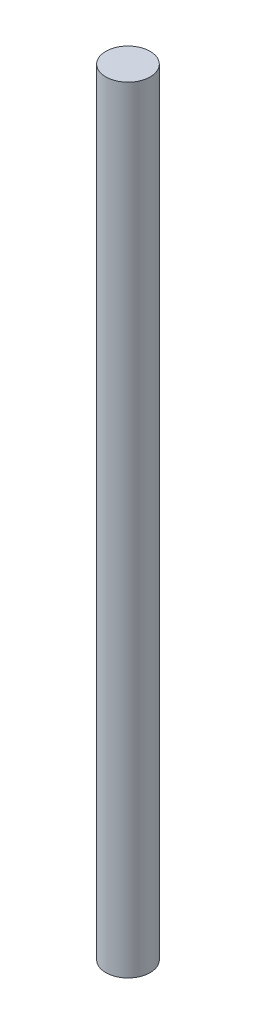
from build123d import *

# Parameters (mm, degrees)
SKETCH1_R           = 1
BOSS_EXTRUDE1_DEPTH = 35


with BuildPart() as part:
    # Sketch1 → Boss-Extrude1 (new body)
    with BuildSketch(Plane(origin=(0, 0, 0), x_dir=(1, 0, 0), z_dir=(0, 1, 0))):
        with Locations(Location((0, 0, 0), (0, 0, 270))):
            Circle(SKETCH1_R)
    extrude(amount=BOSS_EXTRUDE1_DEPTH)


solid = part.part
